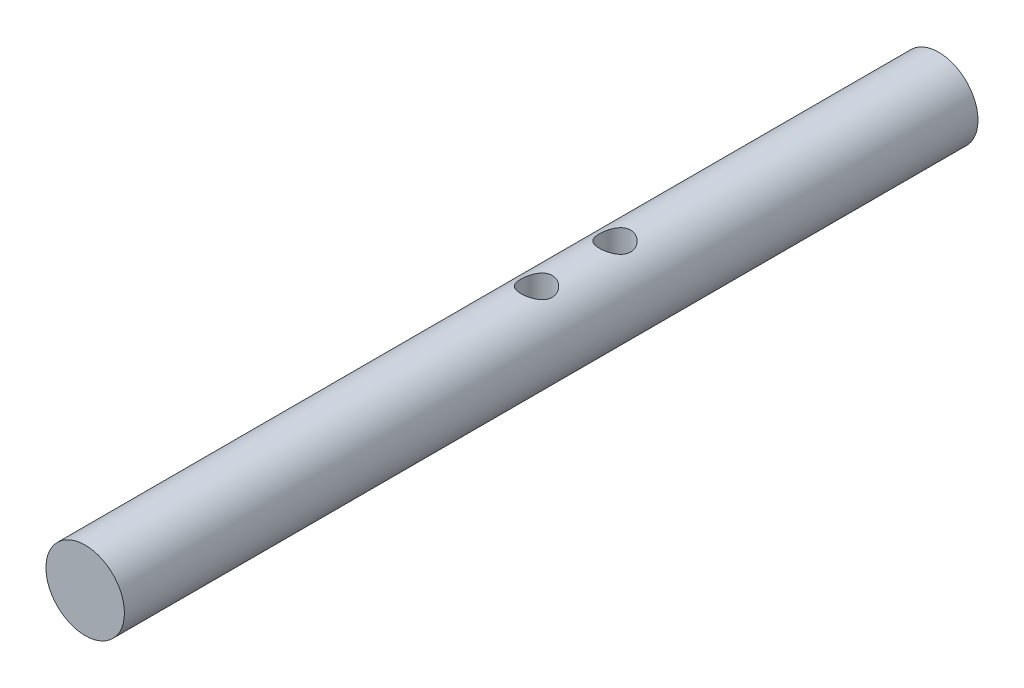
from build123d import *

# Parameters (mm, degrees)
SKETCH_304_R          = 4
EXTRUDE_349_DEPTH     = 87
SKETCH_433_R          = 1.6
CUT_EXTRUDE_530_DEPTH = 88.458561616


with BuildPart() as part:
    # Sketch 304 → Extrude 349 (new body)
    with BuildSketch(Plane.XY):
        Circle(SKETCH_304_R)
    extrude(amount=EXTRUDE_349_DEPTH)

    # Sketch 433 → Cut-Extrude 530 (cut, through all)
    with BuildSketch(Plane(origin=(0, 4, 0), x_dir=(1, 0, 0), z_dir=(0, 1, 0))):
        with Locations((0, -33)):
            Circle(SKETCH_433_R)
        with Locations((0, -41)):
            Circle(SKETCH_433_R)
    extrude(amount=-CUT_EXTRUDE_530_DEPTH, mode=Mode.SUBTRACT)


solid = part.part
